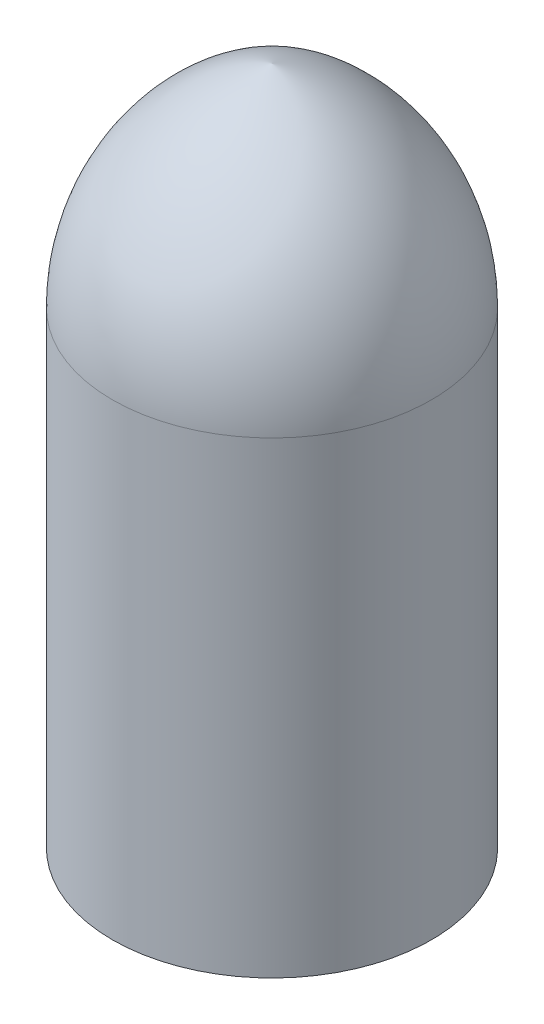
from build123d import *


with BuildPart() as part:
    # Sketch1 → Revolve3 (revolve)
    with BuildSketch(Plane.XY, mode=Mode.PRIVATE) as revolve3_sk:
        with BuildLine():
            Line((57, 0), (58, 0))
            Line((58, 0), (58, 170))
            ThreePointArc((58, 170), (41.873834296, 218.154039035), (0, 246.884627213))
            Line((0, 246.884627213), (0, 245.8441024))
            ThreePointArc((0, 245.8441024), (41.161458118, 217.437664015), (57, 170))
            Line((57, 170), (57, 0))
        make_face()
    revolve(revolve3_sk.sketch.rotate(Axis((0, 240.623917372, 0), (0, 1, 0)), 90), axis=Axis((0, 240.623917372, 0), (0, 1, 0)))


solid = part.part
